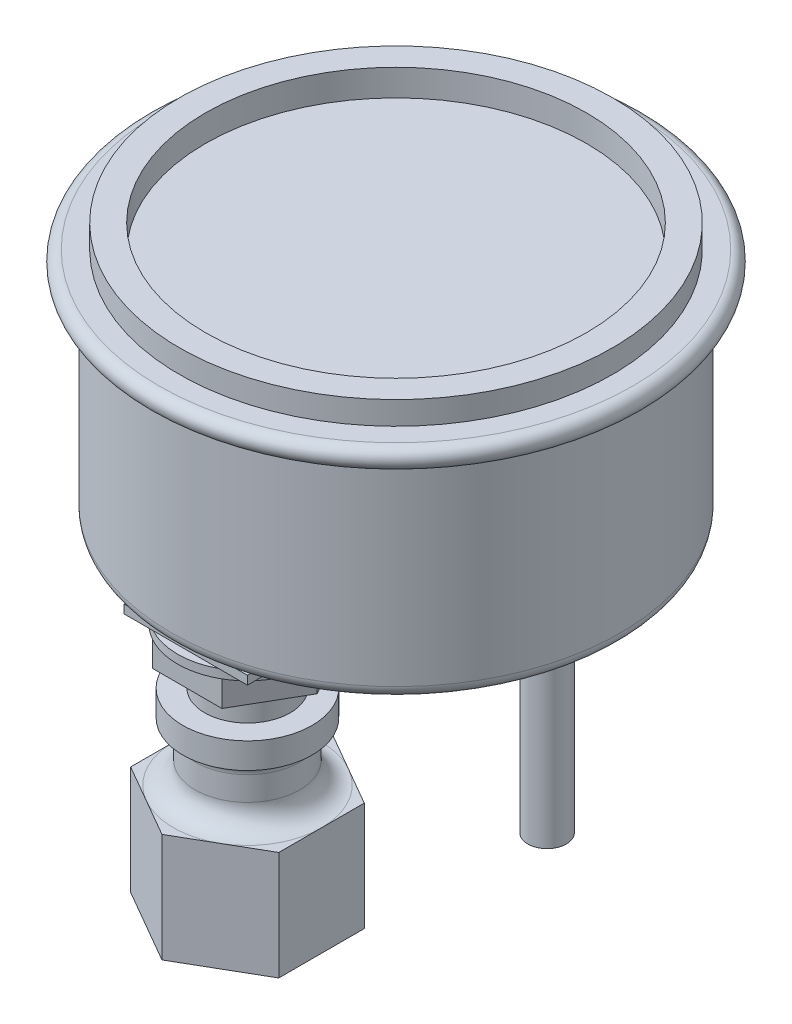
from build123d import *

# Parameters (mm, degrees)
SKETCH2_R           = 4.3
BOSS_EXTRUDE1_DEPTH = 1.8
SKETCH3_R           = 2.25
BOSS_EXTRUDE2_DEPTH = 21.2
SKETCH4_R           = 2.25
BOSS_EXTRUDE3_DEPTH = 14.8
SKETCH5_W           = 14.4
SKETCH5_H           = 14.4
BOSS_EXTRUDE4_DEPTH = 1
SKETCH6_R           = 8.15
BOSS_EXTRUDE5_DEPTH = 1
BOSS_EXTRUDE6_DEPTH = 3
SKETCH9_R           = 5.6
BOSS_EXTRUDE7_DEPTH = 12.7


with BuildPart() as part:
    # Sketch1 → Revolve1 (revolve)
    with BuildSketch(Plane.XY, mode=Mode.PRIVATE) as revolve1_sk:
        with BuildLine():
            Line((0, 0), (0, 26.8))
            Line((0, 26.8), (22.25, 26.8))
            Line((22.25, 26.8), (22.25, 29.9))
            Line((22.25, 29.9), (25.3, 29.9))
            Line((25.3, 29.9), (25.3, 27.2))
            Line((25.3, 27.2), (27.65, 27.2))
            ThreePointArc((27.65, 27.2), (28.85, 26), (27.65, 24.8))
            Line((27.65, 24.8), (26.2, 24.8))
            Line((26.2, 24.8), (26.2, 1.5))
            ThreePointArc((26.2, 1.5), (25.760660172, 0.439339828), (24.7, 0))
            Line((24.7, 0), (0, 0))
        make_face()
    revolve(revolve1_sk.sketch.rotate(Axis((0, -4.069589206, 0), (0, 1, 0)), 90), axis=Axis((0, -4.069589206, 0), (0, 1, 0)))

    # Sketch2 → Boss-Extrude1 (add)
    with BuildSketch(Plane.XZ):
        with Locations(Location((-17.65, 0, 0), (0, 0, 270))):
            Circle(SKETCH2_R)
        with Locations(Location((0, -17.65, 0), (0, 0, 270))):
            Circle(SKETCH2_R)
        with Locations(Location((17.65, 0, 0), (0, 0, 270))):
            Circle(SKETCH2_R)
    extrude(amount=BOSS_EXTRUDE1_DEPTH)

    # Sketch3 → Boss-Extrude2 (add)
    with BuildSketch(Plane.XZ.offset(1.8)):
        with Locations(Location((-17.65, 0, 0), (0, 0, 270))):
            Circle(SKETCH3_R)
        with Locations(Location((17.65, 0, 0), (0, 0, 270))):
            Circle(SKETCH3_R)
    extrude(amount=BOSS_EXTRUDE2_DEPTH)

    # Sketch4 → Boss-Extrude3 (add)
    with BuildSketch(Plane.XZ.offset(1.8)):
        with Locations(Location((0, -17.65, 0), (0, 0, 270))):
            Circle(SKETCH4_R)
    extrude(amount=BOSS_EXTRUDE3_DEPTH)

    # Sketch5 → Boss-Extrude4 (add)
    with BuildSketch(Plane.XZ):
        with Locations((0, 17.35)):
            Rectangle(SKETCH5_W, SKETCH5_H)
    extrude(amount=BOSS_EXTRUDE4_DEPTH)

    # Sketch6 → Boss-Extrude5 (add)
    with BuildSketch(Plane.XZ.offset(1)):
        with Locations(Location((0, 17.35, 0), (0, 0, 62.059614161))):
            Circle(SKETCH6_R)
    extrude(amount=BOSS_EXTRUDE5_DEPTH)

    # Sketch7 → Boss-Extrude6 (add)
    with BuildSketch(Plane.XZ.offset(2)):
        Polygon((8.140638796, 17.35), (4.070319398, 24.4), (-4.070319398, 24.4), (-8.140638796, 17.35), (-4.070319398, 10.3), (4.070319398, 10.3), align=None)
    extrude(amount=BOSS_EXTRUDE6_DEPTH)

    # Sketch8 → Revolve2 (revolve)
    with BuildSketch(Plane(origin=(7.512770378, 0, 4.3375), x_dir=(0.49999999999999983, 0, -0.8660254037844388), z_dir=(0.8660254037844387, 0, 0.4999999999999998)), mode=Mode.PRIVATE) as revolve2_sk:
        with BuildLine():
            Line((-20.025540756, -5), (-20.025540756, -8.5))
            Line((-20.025540756, -8.5), (-22.575540756, -8.5))
            Line((-22.575540756, -8.5), (-22.575540756, -11.5))
            ThreePointArc((-22.575540756, -11.5), (-21.550235923, -11.924695167), (-21.125540756, -12.95))
            Line((-21.125540756, -12.95), (-21.125540756, -15.75))
            ThreePointArc((-21.125540756, -15.75), (-21.872418464, -17.553122292), (-23.675540756, -18.3))
            Line((-23.675540756, -18.3), (-15.025540756, -18.3))
            Line((-15.025540756, -18.3), (-15.025540756, -5))
            Line((-15.025540756, -5), (-20.025540756, -5))
        make_face()
    revolve(revolve2_sk.sketch.rotate(Axis((0, -16.584161667, 17.35), (0, 1, 0)), 210), axis=Axis((0, -16.584161667, 17.35), (0, 1, 0)))

    # Sketch9 → Boss-Extrude7 (add)
    with BuildSketch(Plane.XZ.offset(18.3)):
        Polygon((0, 27.338159657), (-8.65, 22.344079828), (-8.65, 12.355920172), (0, 7.361840343), (8.65, 12.355920172), (8.65, 22.344079828), align=None)
        with Locations(Location((0, 17.35, 0), (0, 0, 270))):
            Circle(SKETCH9_R, mode=Mode.SUBTRACT)
    extrude(amount=BOSS_EXTRUDE7_DEPTH)


solid = part.part
